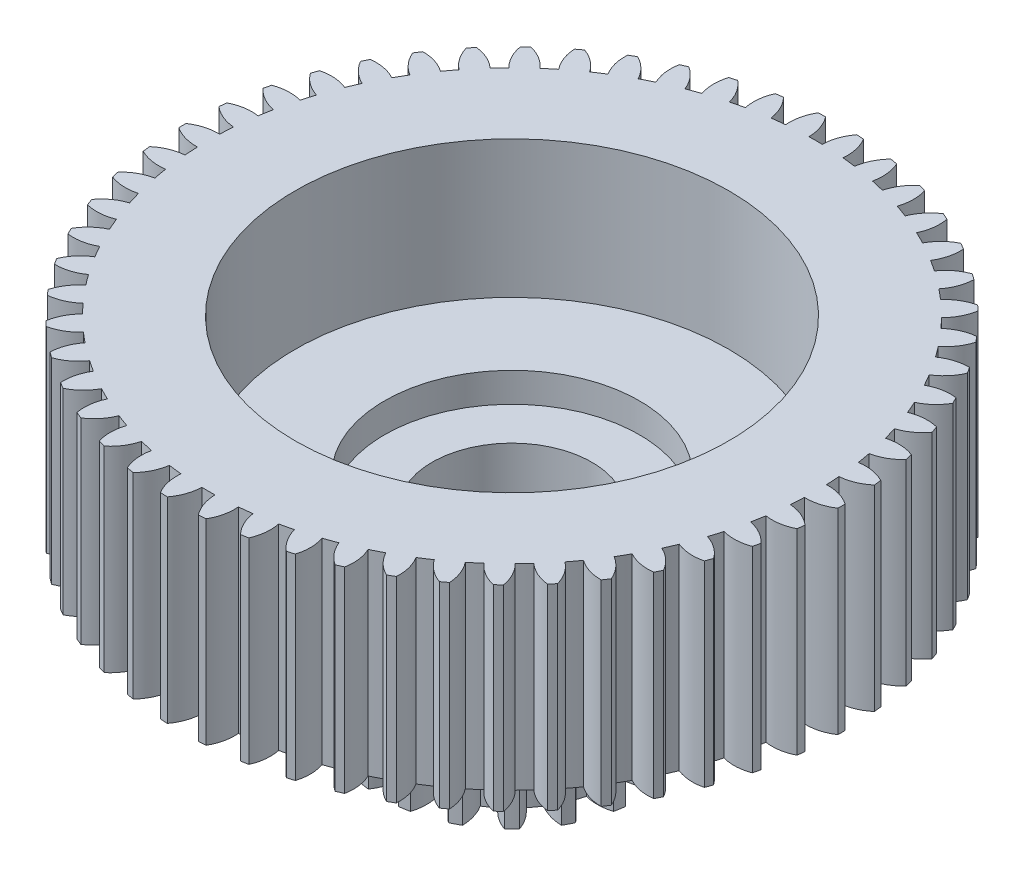
from build123d import *

# Parameters (mm, degrees)
SKIZZE1_R                       = 6.6
SKIZZE1_R_2                     = 4.075
AUFSATZ_LINEAR_AUSTRAGEN1_DEPTH = 8
SKIZZE2_R                       = 16.8
SKIZZE2_R_2                     = 4.075
AUFSATZ_LINEAR_AUSTRAGEN2_DEPTH = 10
SKIZZE3_R                       = 11.05
SCHNITT_LINEAR_AUSTRAGEN1_DEPTH = 7
SCHNITT_LINEAR_AUSTRAGEN2_DEPTH = 8
KREISMUSTER1_COUNT              = 20
SCHNITT_LINEAR_START            = -10
SCHNITT_LINEAR_AUSTRAGEN3_DEPTH = 10
KREISMUSTER2_COUNT              = 54
SKIZZE7_R                       = 6.5
SCHNITT_LINEAR_AUSTRAGEN4_DEPTH = 1.5


with BuildPart() as part:
    # Skizze1 → Aufsatz-Linear austragen1 (new body)
    with BuildSketch(Plane(origin=(0, 0, 0), x_dir=(1, 0, 0), z_dir=(0, 1, 0))):
        with Locations(Location((0, 0, 0), (0, 0, 270))):
            Circle(SKIZZE1_R)
        with Locations(Location((0, 0, 0), (0, 0, 270))):
            Circle(SKIZZE1_R_2, mode=Mode.SUBTRACT)
    extrude(amount=AUFSATZ_LINEAR_AUSTRAGEN1_DEPTH)

    # Skizze2 → Aufsatz-Linear austragen2 (add)
    with BuildSketch(Plane(origin=(0, 8, 0), x_dir=(1, 0, 0), z_dir=(0, 1, 0))):
        with Locations(Location((0, 0, 0), (0, 0, 270))):
            Circle(SKIZZE2_R)
        with Locations(Location((0, 0, 0), (0, 0, 270))):
            Circle(SKIZZE2_R_2, mode=Mode.SUBTRACT)
    extrude(amount=AUFSATZ_LINEAR_AUSTRAGEN2_DEPTH)

    # Skizze3 → Schnitt-Linear austragen1 (cut)
    with BuildSketch(Plane(origin=(0, 18, 0), x_dir=(1, 0, 0), z_dir=(0, 1, 0))):
        with Locations(Location((0, 0, 0), (0, 0, 270))):
            Circle(SKIZZE3_R)
    extrude(amount=-SCHNITT_LINEAR_AUSTRAGEN1_DEPTH, mode=Mode.SUBTRACT)

    # Skizze5 → Schnitt-Linear austragen2 (cut)
    with BuildSketch(Plane.XZ):
        with BuildLine():
            ThreePointArc((0.322758026, 5.270125924), (0.457118307, 5.943079048), (0.767210849, 6.55525648))
            ThreePointArc((0.767210849, 6.55525648), (0, 6.6), (-0.767210849, 6.55525648))
            ThreePointArc((-0.767210849, 6.55525648), (-0.457118307, 5.943079048), (-0.322758026, 5.270125924))
            ThreePointArc((-0.322758026, 5.270125924), (0, 5.28), (0.322758026, 5.270125924))
        make_face()
    schnitt_linear_austragen2 = extrude(amount=-SCHNITT_LINEAR_AUSTRAGEN2_DEPTH, mode=Mode.SUBTRACT)

    # Kreismuster1: Schnitt-Linear austragen2 ×20 about axis
    kreismuster1_axis = Axis((0, 0, 0), (0, 1, 0))
    for i in range(1, KREISMUSTER1_COUNT):
        add(schnitt_linear_austragen2.rotate(kreismuster1_axis, i * 360 / KREISMUSTER1_COUNT), mode=Mode.SUBTRACT)

    # Skizze6 → Schnitt-Linear austragen3 (cut)
    with BuildSketch(Plane(origin=(0, 18, 0), x_dir=(1, 0, 0), z_dir=(0, 1, 0)).offset(SCHNITT_LINEAR_START)):
        with BuildLine():
            ThreePointArc((0.336724731, 15.476337307), (0.46108779, 16.164849804), (0.791960149, 16.781322925))
            ThreePointArc((0.791960149, 16.781322925), (0, 16.8), (-0.791960149, 16.781322925))
            ThreePointArc((-0.791960149, 16.781322925), (-0.46108779, 16.164849804), (-0.336724731, 15.476337307))
            ThreePointArc((-0.336724731, 15.476337307), (0, 15.48), (0.336724731, 15.476337307))
        make_face()
    schnitt_linear_austragen3 = extrude(amount=SCHNITT_LINEAR_AUSTRAGEN3_DEPTH, mode=Mode.SUBTRACT)

    # Kreismuster2: Schnitt-Linear austragen3 ×54 about axis
    kreismuster2_axis = Axis((0, 0, 0), (0, 1, 0))
    for i in range(1, KREISMUSTER2_COUNT):
        add(schnitt_linear_austragen3.rotate(kreismuster2_axis, i * 360 / KREISMUSTER2_COUNT), mode=Mode.SUBTRACT)

    # Skizze7 → Schnitt-Linear austragen4 (cut)
    with BuildSketch(Plane(origin=(0, 11, 0), x_dir=(1, 0, 0), z_dir=(0, 1, 0))):
        with Locations(Location((0, 0, 0), (0, 0, 270))):
            Circle(SKIZZE7_R)
    extrude(amount=-SCHNITT_LINEAR_AUSTRAGEN4_DEPTH, mode=Mode.SUBTRACT)


solid = part.part
